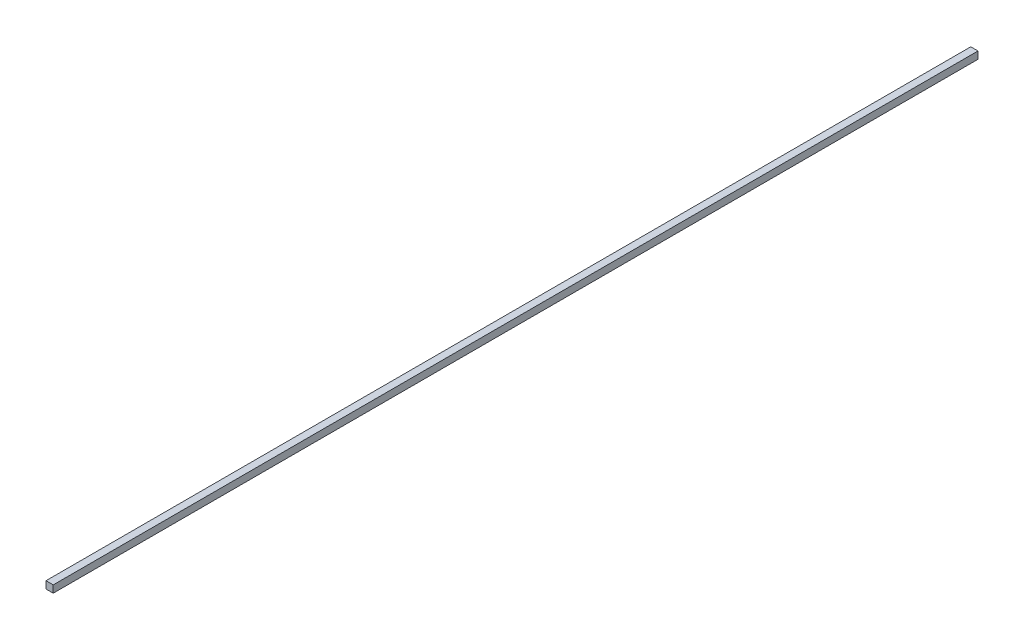
from build123d import *

# Parameters (mm, degrees)
BOSS_EXTRUDE1_DEPTH      = 152.4
BOSS_EXTRUDE1_DEPTH_BACK = 152.4
SKETCH3_W                = 2.38125
SKETCH3_H                = 2.38125


with BuildPart() as part:
    # Sketch3 → Boss-Extrude1 (new, two sides: drawn at the far end of the back side and taken through both)
    with BuildSketch(Plane.XY.offset(-BOSS_EXTRUDE1_DEPTH_BACK)):
        Rectangle(SKETCH3_W, SKETCH3_H)
    extrude(amount=BOSS_EXTRUDE1_DEPTH + BOSS_EXTRUDE1_DEPTH_BACK)


solid = part.part
